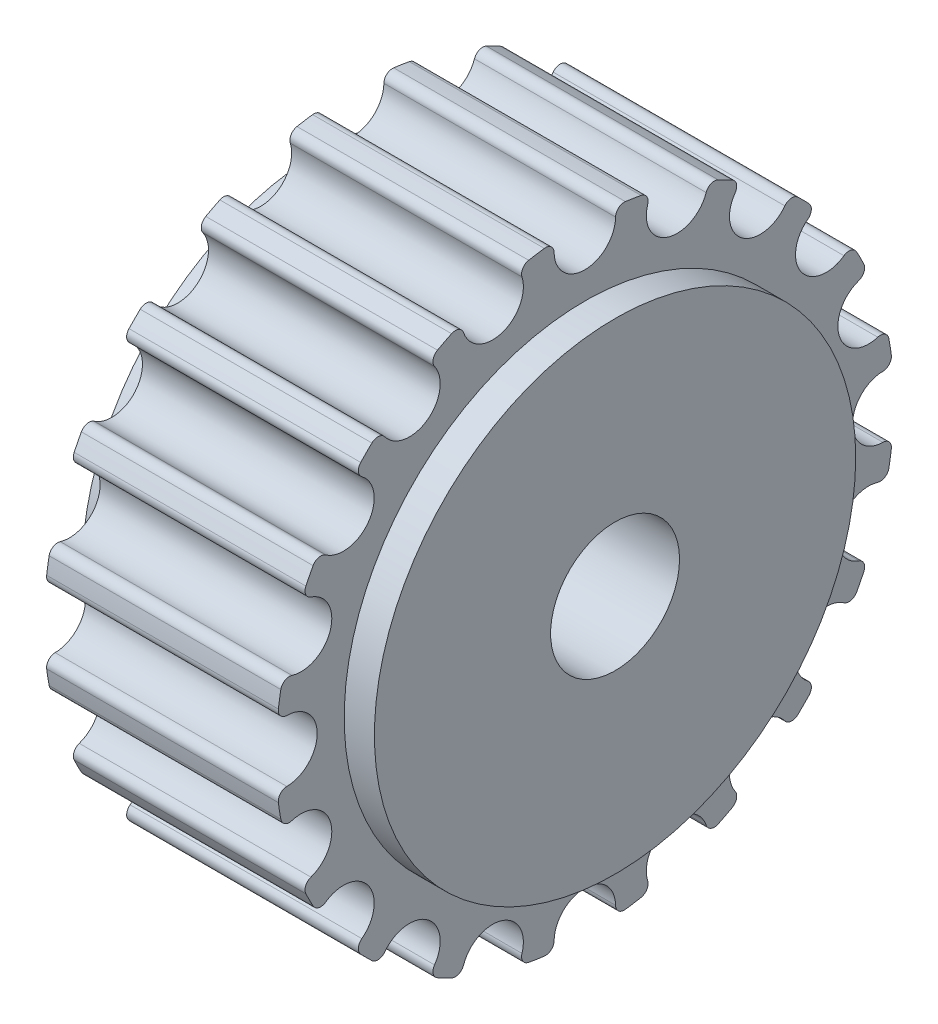
from build123d import *

# Parameters (mm, degrees)
BOSS_EXTRUDE1_DEPTH = 5.75
CIRPATTERN1_COUNT   = 20
SKETCH2_R           = 11.945
BOSS_EXTRUDE2_DEPTH = 1.5
SKETCH3_R           = 3.2
CUT_EXTRUDE1_DEPTH  = 14.5


with BuildPart() as part:
    # Sketch1 → Boss-Extrude1 (new, symmetric)
    with BuildSketch(Plane(origin=(0, 0, 0), x_dir=(0, 0, -1), z_dir=(1, 0, 0))):
        with BuildLine():
            Line((0, 13.285), (0, 0))
            Line((0, 0), (4.10529077, 12.634785819))
            ThreePointArc((4.10529077, 12.634785819), (3.221971668, 13.384600745), (3.120582785, 14.538808418))
            ThreePointArc((3.120582785, 14.538808418), (3.07819699, 14.888914891), (2.788180956, 15.089568316))
            ThreePointArc((2.788180956, 15.089568316), (2.400486866, 15.156077586), (2.011215381, 15.212627574))
            ThreePointArc((2.011215381, 15.212627574), (1.673388423, 15.111414709), (1.524888287, 14.791541599))
            ThreePointArc((1.524888287, 14.791541599), (1.071791943, 13.725155757), (0, 13.285))
        make_face()
    boss_extrude1 = extrude(amount=BOSS_EXTRUDE1_DEPTH, both=True)

    # CirPattern1: Boss-Extrude1 ×20 about axis
    cirpattern1_axis = Axis((0, 0, 0), (1, 0, 0))
    for i in range(1, CIRPATTERN1_COUNT):
        add(boss_extrude1.rotate(cirpattern1_axis, i * 360 / CIRPATTERN1_COUNT))

    # Sketch2 → Boss-Extrude2 (add)
    with BuildSketch(Plane(origin=(5.75, 0, 0), x_dir=(0, 0, -1), z_dir=(1, 0, 0))):
        Circle(SKETCH2_R)
    boss_extrude2 = extrude(amount=BOSS_EXTRUDE2_DEPTH)

    # Mirror1: Boss-Extrude2 across plane
    add(boss_extrude2.mirror(Plane(origin=(0, 0, 0), x_dir=(0, 0, 1), z_dir=(1, 0, 0))))

    # Sketch3 → Cut-Extrude1 (cut)
    with BuildSketch(Plane(origin=(7.25, 0, 0), x_dir=(0, 0, -1), z_dir=(1, 0, 0))):
        Circle(SKETCH3_R)
    extrude(amount=-CUT_EXTRUDE1_DEPTH, mode=Mode.SUBTRACT)


solid = part.part
